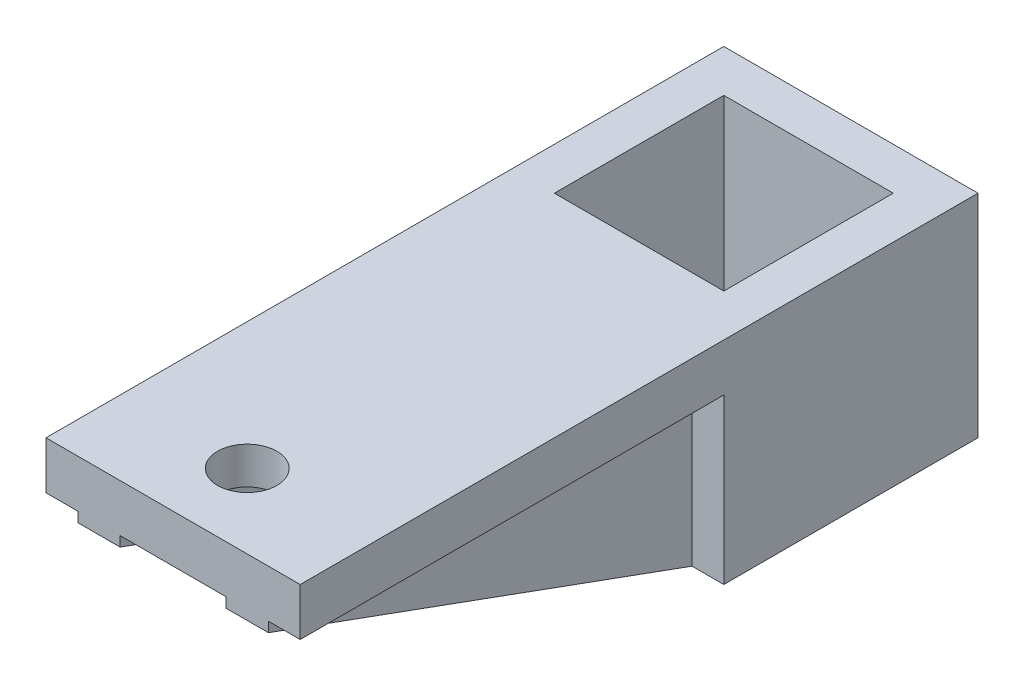
from build123d import *

# Parameters (mm, degrees)
SKETCH_1_W               = 24
SKETCH_1_H               = 24
SKETCH_1_W_2             = 16
SKETCH_1_H_2             = 16
EXTRUDE_1_DEPTH          = 20
SKETCH_2_W               = 24
SKETCH_2_H               = 4.5
EXTRUDE_2_DEPTH          = 40
CUT_EXTRUDE_1_DEPTH      = 40
CUT_EXTRUDE_1_DEPTH_BACK = 40
SKETCH_3_R               = 2.8
SKETCH_6_W               = 4
SKETCH_6_H               = 40
EXTRUDE_3_DEPTH          = 15.5
CHAMFER_1_SIZE           = 40
CHAMFER_1_SIZE2          = 14.558809371
SKETCH_7_R               = 5
CUT_EXTRUDE_2_DEPTH      = 1


with BuildPart() as part:
    # 草图1 → 凸台-拉伸1 (new body)
    with BuildSketch(Plane(origin=(0, 0, 0), x_dir=(1, 0, 0), z_dir=(0, 1, 0))):
        with Locations((8, 8)):
            Rectangle(SKETCH_1_W, SKETCH_1_H)
        with Locations((8, 8)):
            Rectangle(SKETCH_1_W_2, SKETCH_1_H_2, mode=Mode.SUBTRACT)
    extrude(amount=EXTRUDE_1_DEPTH)

    # 草图2 → 凸台-拉伸2 (add)
    with BuildSketch(Plane.XY.offset(4)):
        with Locations((8, 17.75)):
            Rectangle(SKETCH_2_W, SKETCH_2_H)
    extrude(amount=EXTRUDE_2_DEPTH)

    # 草图3 → 切除-拉伸1 (cut, two sides: drawn at the far end of the back side and taken through both)
    with BuildSketch(Plane(origin=(0, 15.5, 0), x_dir=(-1, 0, 0), z_dir=(0, -1, 0)).offset(-CUT_EXTRUDE_1_DEPTH_BACK)):
        with Locations(Location((-8, -37, 0), (0, 0, 270))):
            Circle(SKETCH_3_R)
    extrude(amount=CUT_EXTRUDE_1_DEPTH + CUT_EXTRUDE_1_DEPTH_BACK, mode=Mode.SUBTRACT)

    # 草图6 → 凸台-拉伸3 (add)
    with BuildSketch(Plane(origin=(0, 15.5, 0), x_dir=(-1, 0, 0), z_dir=(0, -1, 0))):
        with Locations((-1, -24)):
            Rectangle(SKETCH_6_W, SKETCH_6_H)
        with Locations((-15, -24)):
            Rectangle(SKETCH_6_W, SKETCH_6_H)
    extrude(amount=EXTRUDE_3_DEPTH)

    # 倒角1
    chamfer_1_edges = [part.edges().sort_by_distance(p)[0] for p in [
        (1, 0, 44),
        (15, 0, 44),
    ]]
    chamfer_1_side = [part.faces().sort_by_distance(p)[0] for p in [
        (-3.3164797, 0, -8),
    ]]
    chamfer(chamfer_1_edges, length=CHAMFER_1_SIZE, length2=CHAMFER_1_SIZE2, reference=chamfer_1_side[0])

    # 草图7 → 切除-拉伸2 (cut)
    with BuildSketch(Plane(origin=(0, 15.5, 0), x_dir=(-1, 0, 0), z_dir=(0, -1, 0))):
        with Locations(Location((-8, -37, 0), (0, 0, 90))):
            Circle(SKETCH_7_R)
    extrude(amount=-CUT_EXTRUDE_2_DEPTH, mode=Mode.SUBTRACT)


solid = part.part
